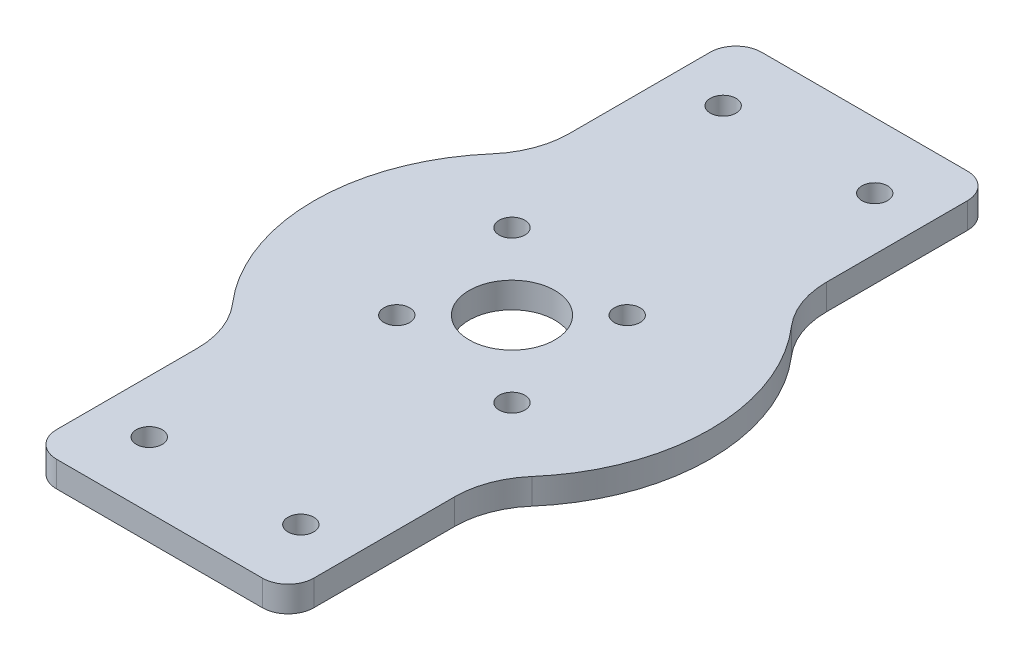
from build123d import *

# Parameters (mm, degrees)
SKETCH1_R           = 1.5
SKETCH1_R_2         = 5
BOSS_EXTRUDE1_DEPTH = 3


with BuildPart() as part:
    # Sketch1 → Boss-Extrude1 (new body)
    with BuildSketch(Plane(origin=(0, 0, 0), x_dir=(1, 0, 0), z_dir=(0, 1, 0))):
        with BuildLine():
            Line((-15, 21.693547428), (-15, 38.108016468))
            ThreePointArc((-15, 38.108016468), (-14.121320344, 40.229336812), (-12, 41.108016468))
            Line((-12, 41.108016468), (12, 41.108016468))
            ThreePointArc((12, 41.108016468), (14.121320344, 40.229336812), (15, 38.108016468))
            Line((15, 38.108016468), (15, 21.693547428))
            ThreePointArc((15, 21.693547428), (15.631737063, 18.195598093), (17.447129909, 15.139605607))
            ThreePointArc((17.447129909, 15.139605607), (23.1, 0), (17.447129909, -15.139605607))
            ThreePointArc((17.447129909, -15.139605607), (15.631737063, -18.195598093), (15, -21.693547428))
            Line((15, -21.693547428), (15, -38.108016468))
            ThreePointArc((15, -38.108016468), (14.121320344, -40.229336812), (12, -41.108016468))
            Line((12, -41.108016468), (-12, -41.108016468))
            ThreePointArc((-12, -41.108016468), (-14.121320344, -40.229336812), (-15, -38.108016468))
            Line((-15, -38.108016468), (-15, -21.693547428))
            ThreePointArc((-15, -21.693547428), (-15.631737063, -18.195598093), (-17.447129909, -15.139605607))
            ThreePointArc((-17.447129909, -15.139605607), (-23.1, 0), (-17.447129909, 15.139605607))
            ThreePointArc((-17.447129909, 15.139605607), (-15.631737063, 18.195598093), (-15, 21.693547428))
        make_face()
        with Locations(Location((-8.838834765, 8.838834765, 0), (0, 0, 270))):
            Circle(SKETCH1_R, mode=Mode.SUBTRACT)
        with Locations(Location((8.838834765, -8.838834765, 0), (0, 0, 90))):
            Circle(SKETCH1_R, mode=Mode.SUBTRACT)
        with Locations(Location((6.717514421, 6.717514421, 0), (0, 0, 270))):
            Circle(SKETCH1_R, mode=Mode.SUBTRACT)
        with Locations(Location((-6.717514421, -6.717514421, 0), (0, 0, 90))):
            Circle(SKETCH1_R, mode=Mode.SUBTRACT)
        with Locations(Location((0, 0, 0), (0, 0, 270))):
            Circle(SKETCH1_R_2, mode=Mode.SUBTRACT)
        with Locations(Location((-8.838834765, 33.462792438, 0), (0, 0, 270))):
            Circle(SKETCH1_R, mode=Mode.SUBTRACT)
        with Locations(Location((8.838834765, 33.462792438, 0), (0, 0, 90))):
            Circle(SKETCH1_R, mode=Mode.SUBTRACT)
        with Locations(Location((8.838834765, -33.462792438, 0), (0, 0, 270))):
            Circle(SKETCH1_R, mode=Mode.SUBTRACT)
        with Locations(Location((-8.838834765, -33.462792438, 0), (0, 0, 90))):
            Circle(SKETCH1_R, mode=Mode.SUBTRACT)
    extrude(amount=BOSS_EXTRUDE1_DEPTH)


solid = part.part
